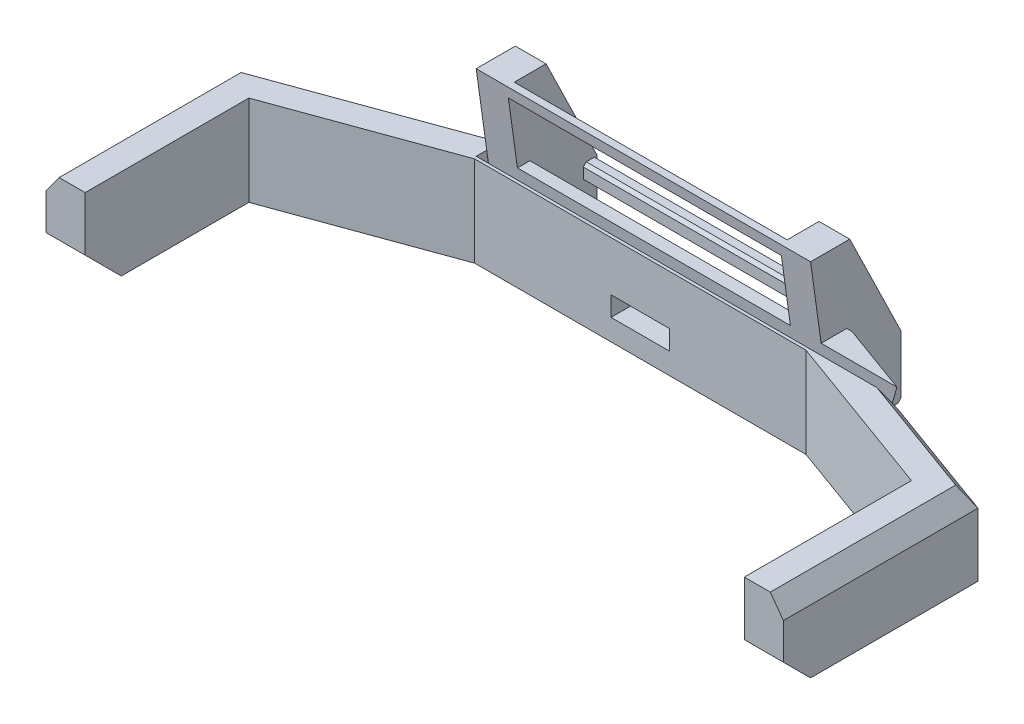
from build123d import *
from OCP.BRepFilletAPI import BRepFilletAPI_MakeChamfer

# Parameters (mm, degrees)
BOSS_EXTRUDE1_DEPTH      = 300
CHAMFER1_SIZE            = 30
CHAMFER2_SIZE            = 120
BOSS_EXTRUDE2_DEPTH      = 180
BOSS_EXTRUDE2_DEPTH_BACK = 120
SKETCH3_W                = 101.940118113
SKETCH3_H                = 551.842685694
CUT_EXTRUDE7_DEPTH       = 1991.965553697
CHAMFER3_SIZE            = 170
CHAMFER3_SIZE2           = 348.551653068
SKETCH6_W                = 46.442322401
SKETCH6_H                = 54.989404456
SKETCH6_H_2              = 57.655849519
BOSS_EXTRUDE3_DEPTH      = 906.440509715
CHAMFER5_SIZE            = 10
CHAMFER5_SIZE2           = 11.720638091
SKETCH7_W                = 359.809632682
SKETCH7_H                = 90.64577865
BOSS_EXTRUDE4_DEPTH      = 20
SKETCH8_W                = 195
SKETCH8_H                = 65
CUT_EXTRUDE8_DEPTH       = 392
SKETCH9_W                = 124.341085276
SKETCH9_H                = 16.237188454
BOSS_EXTRUDE5_DEPTH      = 5
CHAMFER6_SIZE            = 60
CHAMFER6_SIZE2           = 43.59255168


with BuildPart() as part:
    # Sketch2 → Boss-Extrude1 (new body)
    with BuildSketch(Plane(origin=(0, 0, 0), x_dir=(1, 0, 0), z_dir=(0, 1, 0))):
        Polygon((-1100, -366.154475502), (-1100, 177.470675031), (-550, 377.470675031), (550, 377.470675031), (1100, 177.470675031), (1100, -377.470675031), (1230, -377.470675031), (1230, 268.52621943), (572.902747098, 507.470675031), (-572.902747098, 507.470675031), (-1230, 268.52621943), (-1230, -366.154475502), align=None)
    extrude(amount=BOSS_EXTRUDE1_DEPTH)

    # Chamfer1
    chamfer1_edges = [part.edges().sort_by_distance(p)[0] for p in [
        (-1230, 0, 48.814128036),
        (-901.451373549, 0, -387.99844723),
        (0, 0, -507.470675031),
        (901.451373549, 0, -387.99844723),
        (1230, 0, 54.4722278),
    ]]
    chamfer(chamfer1_edges, length=CHAMFER1_SIZE)

    # Chamfer2
    chamfer2_edges = [part.edges().sort_by_distance(p)[0] for p in [
        (-1150, 0, 366.154475502),
        (1150, 0, 377.470675031),
    ]]
    chamfer(chamfer2_edges, length=CHAMFER2_SIZE)

    # Sketch3 → Boss-Extrude2 (add, two sides: drawn at the far end of the back side and taken through both)
    with BuildSketch(Plane(origin=(0, 0, -507.470675031), x_dir=(-1, 0, 0), z_dir=(0, 0, -1)).offset(-BOSS_EXTRUDE2_DEPTH_BACK)):
        with Locations((-504.190313915, 275.921342847)):
            Rectangle(SKETCH3_W, SKETCH3_H)
        with Locations((504.190313915, 275.921342847)):
            Rectangle(SKETCH3_W, SKETCH3_H)
    extrude(amount=BOSS_EXTRUDE2_DEPTH + BOSS_EXTRUDE2_DEPTH_BACK)

    # Sketch5 → Cut-Extrude7 (cut, through all)
    with BuildSketch(Plane.ZY.offset(555.160372971)):
        Polygon((-387.470675031, 551.842685694), (-433.497227826, 219.864084998), (-387.470675031, 300), align=None)
    extrude(amount=-CUT_EXTRUDE7_DEPTH, mode=Mode.SUBTRACT)

    # Chamfer3: one chamfer whose edges measure the first distance from different faces: ONE call of the kernel's chamfer builder (chamfer() names one face for all edges)
    chamfer3_edges_1 = [part.edges().sort_by_distance(p)[0] for p in [
        (-504.190313915, 551.842685694, -687.470675031),
    ]]
    chamfer3_side_1 = [part.faces().sort_by_distance(p)[0] for p in [
        (-504.190313915, 551.842685694, -537.470675031),
    ]]
    chamfer3_edges_2 = [part.edges().sort_by_distance(p)[0] for p in [
        (504.190313915, 551.842685694, -687.470675031),
    ]]
    chamfer3_side_2 = [part.faces().sort_by_distance(p)[0] for p in [
        (504.190313915, 551.842685694, -537.470675031),
    ]]
    chamfer3 = BRepFilletAPI_MakeChamfer(part.part.solid().wrapped)
    for e in chamfer3_edges_1:
        chamfer3.Add(CHAMFER3_SIZE, CHAMFER3_SIZE2, e.wrapped, chamfer3_side_1[0].wrapped)  # the first distance lies on this face
    for e in chamfer3_edges_2:
        chamfer3.Add(CHAMFER3_SIZE, CHAMFER3_SIZE2, e.wrapped, chamfer3_side_2[0].wrapped)  # the first distance lies on this face
    add(Compound.cast(chamfer3.Shape()), mode=Mode.REPLACE)

    # Sketch6 → Boss-Extrude3 (add)
    with BuildSketch(Plane(origin=(-453.220254858, 0, 0), x_dir=(0, 0, -1), z_dir=(1, 0, 0))):
        Polygon((387.470675031, 551.842685694), (393.758008235, 506.493643621), (421.699837769, 506.493643621), (421.699837769, 551.842685694), align=None)
        with Locations((664.249513831, 175.796330397)):
            Rectangle(SKETCH6_W, SKETCH6_H)
        with Locations((664.249513831, 28.82792476)):
            Rectangle(SKETCH6_W, SKETCH6_H_2)
    extrude(amount=BOSS_EXTRUDE3_DEPTH)

    # Chamfer5: one chamfer whose edges measure the first distance from different faces: ONE call of the kernel's chamfer builder (chamfer() names one face for all edges)
    chamfer5_edges_1 = [part.edges().sort_by_distance(p)[0] for p in [
        (0, 506.493643621, -421.699837769),
        (0, 551.842685694, -421.699837769),
        (0, 148.301628169, -641.02835263),
        (0, 203.291032625, -641.02835263),
        (0, 203.291032625, -687.470675031),
        (0, 148.301628169, -687.470675031),
        (0, 0, -641.02835263),
        (0, 57.655849519, -641.02835263),
        (0, 57.655849519, -687.470675031),
        (0, 0, -687.470675031),
    ]]
    chamfer5_edges_2 = [part.edges().sort_by_distance(p)[0] for p in [
        (0, 506.493643621, -393.758008235),
    ]]
    chamfer5_side_2 = [part.faces().sort_by_distance(p)[0] for p in [
        (-541.133646758, 425.921342847, -404.928804327),
    ]]
    chamfer5 = BRepFilletAPI_MakeChamfer(part.part.solid().wrapped)
    for e in chamfer5_edges_1:
        chamfer5.Add(CHAMFER5_SIZE, e.wrapped)
    for e in chamfer5_edges_2:
        chamfer5.Add(CHAMFER5_SIZE, CHAMFER5_SIZE2, e.wrapped, chamfer5_side_2[0].wrapped)  # the first distance lies on this face
    add(Compound.cast(chamfer5.Shape()), mode=Mode.REPLACE)

    # Sketch7 → Boss-Extrude4 (add)
    with BuildSketch(Plane(origin=(0, 0, -507.470675031), x_dir=(-1, 0, 0), z_dir=(0, 0, -1))):
        with Locations((0, 102.978738844)):
            Rectangle(SKETCH7_W, SKETCH7_H)
    extrude(amount=BOSS_EXTRUDE4_DEPTH)

    # Sketch8 → Cut-Extrude8 (cut)
    with BuildSketch(Plane(origin=(0, 0, -527.470675031), x_dir=(-1, 0, 0), z_dir=(0, 0, -1))):
        with Locations((0, 102.978738844)):
            Rectangle(SKETCH8_W, SKETCH8_H)
    extrude(amount=-CUT_EXTRUDE8_DEPTH, mode=Mode.SUBTRACT)

    # Sketch9 → Boss-Extrude5 (add)
    with BuildSketch(Plane(origin=(0, 0, -421.699837769), x_dir=(-1, 0, 0), z_dir=(0, 0, -1))):
        with Locations((-358.63050058, 528.640825731)):
            Rectangle(SKETCH9_W, SKETCH9_H)
        with Locations((-118.63050058, 528.640825731)):
            Rectangle(SKETCH9_W, SKETCH9_H)
        with Locations((121.36949942, 528.640825731)):
            Rectangle(SKETCH9_W, SKETCH9_H)
        with Locations((361.36949942, 528.640825731)):
            Rectangle(SKETCH9_W, SKETCH9_H)
    extrude(amount=BOSS_EXTRUDE5_DEPTH)

    # Chamfer6: one chamfer whose edges measure the first distance from different faces: ONE call of the kernel's chamfer builder (chamfer() names one face for all edges)
    chamfer6_edges_1 = [part.edges().sort_by_distance(p)[0] for p in [
        (-1230, 300, 48.814128036),
    ]]
    chamfer6_side_1 = [part.faces().sort_by_distance(p)[0] for p in [
        (-1230, 167.541631542, 41.858763366),
    ]]
    chamfer6_edges_2 = [part.edges().sort_by_distance(p)[0] for p in [
        (-901.451373549, 300, -387.99844723),
    ]]
    chamfer6_side_2 = [part.faces().sort_by_distance(p)[0] for p in [
        (-901.451373549, 165, -387.99844723),
    ]]
    chamfer6_edges_3 = [part.edges().sort_by_distance(p)[0] for p in [
        (0, 300, -507.470675031),
    ]]
    chamfer6_side_3 = [part.faces().sort_by_distance(p)[0] for p in [
        (0, 174.536120756, -507.470675031),
    ]]
    chamfer6_edges_4 = [part.edges().sort_by_distance(p)[0] for p in [
        (1066.451373549, 300, -327.99844723),
    ]]
    chamfer6_side_4 = [part.faces().sort_by_distance(p)[0] for p in [
        (903.063859392, 162.599697247, -387.412088742),
    ]]
    chamfer6_edges_5 = [part.edges().sort_by_distance(p)[0] for p in [
        (1230, 300, 54.4722278),
    ]]
    chamfer6_side_5 = [part.faces().sort_by_distance(p)[0] for p in [
        (1230, 167.496050319, 47.507095726),
    ]]
    chamfer6 = BRepFilletAPI_MakeChamfer(part.part.solid().wrapped)
    for e in chamfer6_edges_1:
        chamfer6.Add(CHAMFER6_SIZE, CHAMFER6_SIZE2, e.wrapped, chamfer6_side_1[0].wrapped)  # the first distance lies on this face
    for e in chamfer6_edges_2:
        chamfer6.Add(CHAMFER6_SIZE, CHAMFER6_SIZE2, e.wrapped, chamfer6_side_2[0].wrapped)  # the first distance lies on this face
    for e in chamfer6_edges_3:
        chamfer6.Add(CHAMFER6_SIZE, CHAMFER6_SIZE2, e.wrapped, chamfer6_side_3[0].wrapped)  # the first distance lies on this face
    for e in chamfer6_edges_4:
        chamfer6.Add(CHAMFER6_SIZE, CHAMFER6_SIZE2, e.wrapped, chamfer6_side_4[0].wrapped)  # the first distance lies on this face
    for e in chamfer6_edges_5:
        chamfer6.Add(CHAMFER6_SIZE, CHAMFER6_SIZE2, e.wrapped, chamfer6_side_5[0].wrapped)  # the first distance lies on this face
    add(Compound.cast(chamfer6.Shape()), mode=Mode.REPLACE)


solid = part.part
